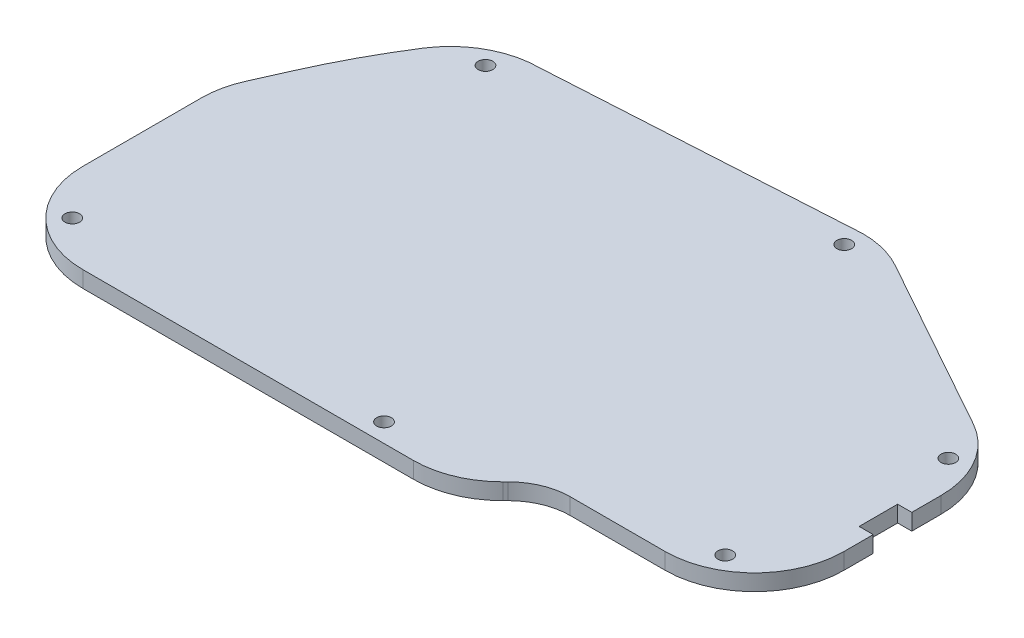
from build123d import *

# Parameters (mm, degrees)
SKETCH2_R           = 1.425
BOSS_EXTRUDE1_DEPTH = 3.175


with BuildPart() as part:
    # Sketch2 → Boss-Extrude1 (new body)
    with BuildSketch(Plane(origin=(0, 0, 0), x_dir=(1, 0, 0), z_dir=(0, 1, 0))):
        with BuildLine():
            Line((-145.18277075, -44.880968233), (-179.497120097, -25.768390824))
            ThreePointArc((-179.497120097, -25.768390824), (-183.588653035, -24.128556812), (-187.960968922, -23.569494069))
            Line((-187.960968922, -23.569494069), (-247.377604545, -27.068041697))
            ThreePointArc((-247.377604545, -27.068041697), (-255.760524502, -29.218913898), (-262.07032604, -35.142257782))
            ThreePointArc((-262.07032604, -35.142257782), (-266.807761783, -43.251676507), (-270.933745897, -51.688632391))
            Line((-270.933745897, -51.688632391), (-273.728235609, -57.981701498))
            ThreePointArc((-273.728235609, -57.981701498), (-274.847170355, -61.434035543), (-275.2256366, -65.043382939))
            Line((-275.2256366, -65.043382939), (-275.2256366, -88.130010281))
            ThreePointArc((-275.2256366, -88.130010281), (-270.129294593, -100.433668273), (-257.8256366, -105.530010281))
            Line((-257.8256366, -105.530010281), (-193.494425739, -105.530010281))
            ThreePointArc((-193.494425739, -105.530010281), (-186.835734016, -104.205514146), (-181.190767747, -100.433668273))
            Line((-181.190767747, -100.433668273), (-180.680815133, -99.923715659))
            ThreePointArc((-180.680815133, -99.923715659), (-176.755292612, -97.300765368), (-172.12482308, -96.379707712))
            Line((-172.12482308, -96.379707712), (-153.649556898, -96.379707712))
            ThreePointArc((-153.649556898, -96.379707712), (-141.345898905, -91.283365704), (-136.249556898, -78.979707712))
            Line((-136.249556898, -78.979707712), (-136.249556898, -73.280889471))
            Line((-136.249556898, -73.280889471), (-138.999556898, -73.280889471))
            Line((-138.999556898, -73.280889471), (-138.999556898, -65.780889471))
            Line((-138.999556898, -65.780889471), (-136.249556898, -65.780889471))
            Line((-136.249556898, -65.780889471), (-136.249556898, -60.08207123))
            ThreePointArc((-136.249556898, -60.08207123), (-138.648188978, -51.266235449), (-145.18277075, -44.880968233))
        make_face()
        with Locations(Location((-147.207602145, -91.127288498, 0), (0, 0, 270))):
            Circle(SKETCH2_R, mode=Mode.SUBTRACT)
        with Locations(Location((-141.795027651, -53.115534334, 0), (0, 0, 270))):
            Circle(SKETCH2_R, mode=Mode.SUBTRACT)
        with Locations(Location((-187.963906245, -27.219493821, 0), (0, 0, 270))):
            Circle(SKETCH2_R, mode=Mode.SUBTRACT)
        with Locations(Location((-253.051529835, -31.941972813, 0), (0, 0, 270))):
            Circle(SKETCH2_R, mode=Mode.SUBTRACT)
        with Locations(Location((-267.548354841, -97.852728522, 0), (0, 0, 270))):
            Circle(SKETCH2_R, mode=Mode.SUBTRACT)
        with Locations(Location((-202.85468144, -101.880010281, 0), (0, 0, 270))):
            Circle(SKETCH2_R, mode=Mode.SUBTRACT)
    extrude(amount=BOSS_EXTRUDE1_DEPTH)


solid = part.part
